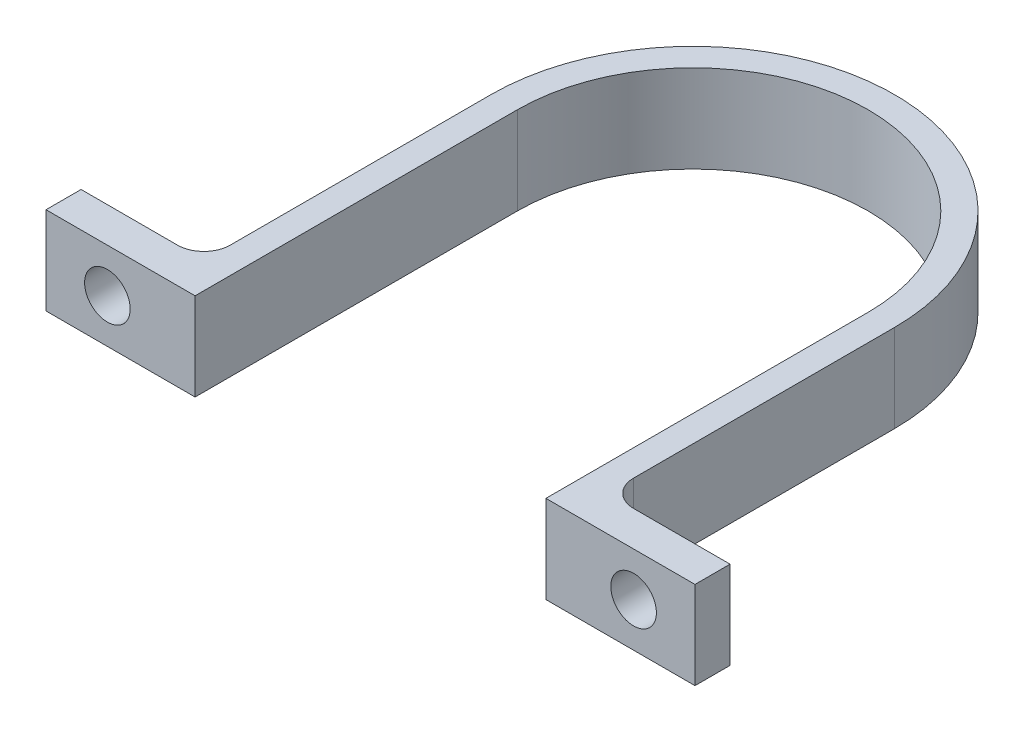
from build123d import *

# Parameters (mm, degrees)
EXTRUDE_1_DEPTH = 10
SKETCH_2_W      = 14
SKETCH_2_H      = 10
SKETCH_2_R      = 2.6
EXTRUDE_2_DEPTH = 4
FILLET_1_R      = 3


with BuildPart() as part:
    # 草图1 → 凸台-拉伸1 (new body)
    with BuildSketch(Plane(origin=(0, 0, 0), x_dir=(1, 0, 0), z_dir=(0, 1, 0))):
        with BuildLine():
            Line((-23, 0), (-23, -36.75))
            Line((-23, -36.75), (-20, -36.75))
            Line((-20, -36.75), (-20, 0))
            ThreePointArc((-20, 0), (0, 20), (20, 0))
            Line((20, 0), (20, -36.75))
            Line((20, -36.75), (23, -36.75))
            Line((23, -36.75), (23, 0))
            ThreePointArc((23, 0), (0, 23), (-23, 0))
        make_face()
    extrude(amount=EXTRUDE_1_DEPTH)

    # 草图2 → 凸台-拉伸2 (add)
    # profile 1 of 2: a face of its own
    with BuildSketch(Plane.XY.offset(36.75)):
        with Locations((-30, 5)):
            Rectangle(SKETCH_2_W, SKETCH_2_H)
        with Locations((-30, 5)):
            Circle(SKETCH_2_R, mode=Mode.SUBTRACT)
    # profile 2 of 2: a face of its own
    with BuildSketch(Plane.XY.offset(36.75)):
        with Locations((30, 5)):
            Rectangle(SKETCH_2_W, SKETCH_2_H)
        with Locations(Location((30, 5, 0), (0, 0, 180))):
            Circle(SKETCH_2_R, mode=Mode.SUBTRACT)
    extrude(amount=-EXTRUDE_2_DEPTH)

    # 圆角1
    fillet_1_edges = [part.edges().sort_by_distance(p)[0] for p in [
        (-23, 5, 32.75),
        (23, 5, 32.75),
    ]]
    fillet(fillet_1_edges, radius=FILLET_1_R)


solid = part.part
